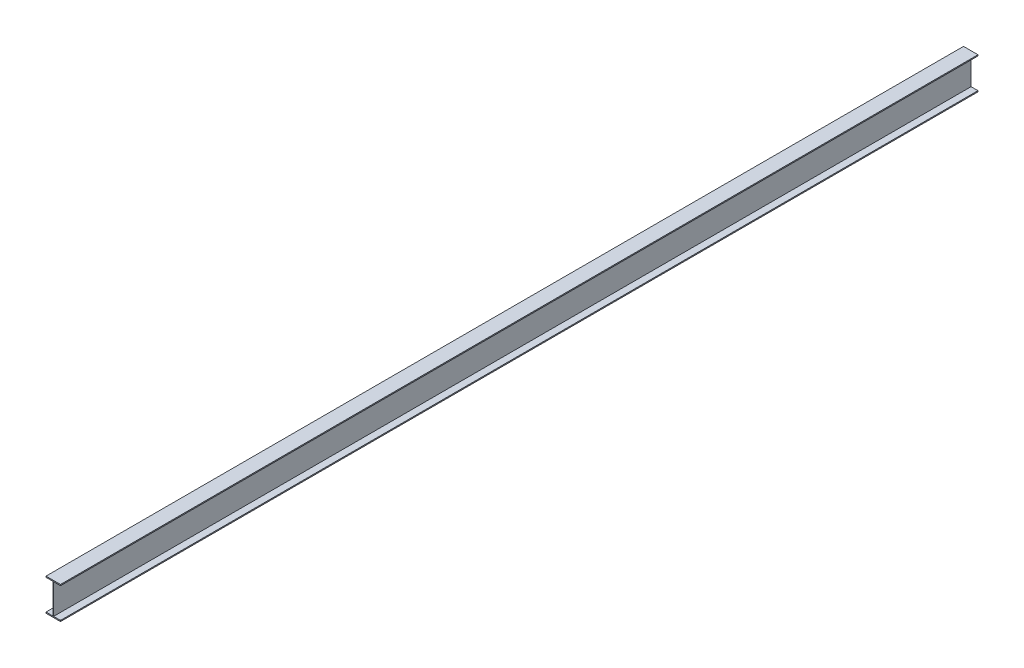
from build123d import *

# Parameters (mm, degrees)
BOSS_EXTRUDE1_DEPTH = 11400


with BuildPart() as part:
    # Sketch1 → Boss-Extrude1 (new body)
    with BuildSketch(Plane.XY):
        Polygon((-72.52489736, -243.4737041), (107.4751026, -243.4737041), (107.4751026, -229.9737041), (21.77510265, -229.9737041), (21.77510265, 143.0262959), (107.47510264, 143.0262959), (107.47510264, 156.5262959), (-72.524897354, 156.5262959), (-72.524897354, 143.0262959), (13.175102646, 143.0262959), (13.175102646, -229.9737041), (-72.52489736, -229.9737041), align=None)
    extrude(amount=BOSS_EXTRUDE1_DEPTH)


solid = part.part
